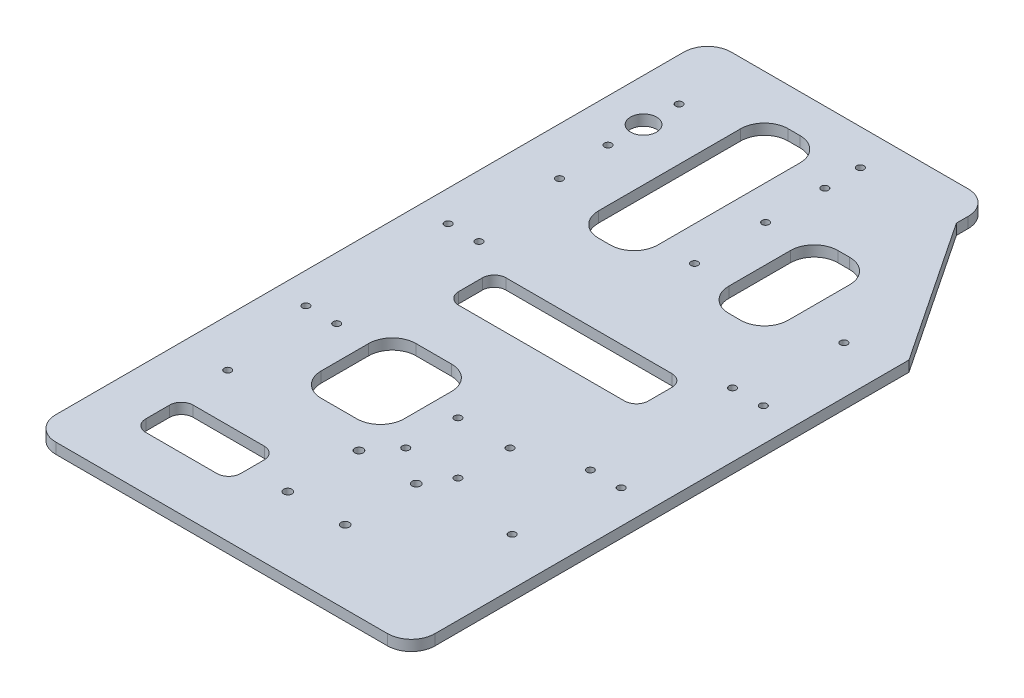
from build123d import *

# Parameters (mm, degrees)
EXTRUDE_1_DEPTH     = 4.5
SKETCH_3_R          = 1.75
CUT_EXTRUDE_2_DEPTH = 297.049404661
SKETCH_4_R          = 1.5
CUT_EXTRUDE_3_DEPTH = 297.049404661
FILLET_1_R          = 10
SKETCH_7_R          = 1.5
CUT_EXTRUDE_4_DEPTH = 297.049404661
SKETCH_8_R          = 1.5
CUT_EXTRUDE_5_DEPTH = 297.049404661
CUT_EXTRUDE_6_DEPTH = 297.049404661
SKETCH_10_R         = 5.5
CUT_EXTRUDE_7_DEPTH = 297.049404661
SKETCH_11_R         = 1.5
CUT_EXTRUDE_8_DEPTH = 297.049404661


with BuildPart() as part:
    # 草图1 → 凸台-拉伸1 (new body)
    with BuildSketch(Plane(origin=(0, 0, 0), x_dir=(1, 0, 0), z_dir=(0, 1, 0))):
        Polygon((-80, 0), (80, 0), (80, 210), (40, 270), (40, 285), (-80, 285), align=None)
    extrude(amount=EXTRUDE_1_DEPTH)

    # 草图3 → 切除-拉伸2 (cut, through all)
    with BuildSketch(Plane(origin=(0, 4.5, 0), x_dir=(1, 0, 0), z_dir=(0, 1, 0))):
        with Locations(Location((-2.95, 60.858418011, 0), (0, 0, 270))):
            Circle(SKETCH_3_R)
        with Locations(Location((21.25, 60.858418011, 0), (0, 0, 270))):
            Circle(SKETCH_3_R)
        with Locations(Location((21.25, 30.858418011, 0), (0, 0, 270))):
            Circle(SKETCH_3_R)
        with Locations(Location((-2.95, 30.858418011, 0), (0, 0, 270))):
            Circle(SKETCH_3_R)
    extrude(amount=-CUT_EXTRUDE_2_DEPTH, mode=Mode.SUBTRACT)

    # 草图4 → 切除-拉伸3 (cut, through all)
    with BuildSketch(Plane(origin=(0, 4.5, 0), x_dir=(1, 0, 0), z_dir=(0, 1, 0))):
        with Locations(Location((-60, 202.548224484, 0), (0, 0, 270))):
            Circle(SKETCH_4_R)
        with Locations(Location((-67, 162.548224484, 0), (0, 0, 270))):
            Circle(SKETCH_4_R)
        with Locations(Location((-54, 162.548224484, 0), (0, 0, 270))):
            Circle(SKETCH_4_R)
        with Locations(Location((-67, 102.548224484, 0), (0, 0, 270))):
            Circle(SKETCH_4_R)
        with Locations(Location((-54, 102.548224484, 0), (0, 0, 270))):
            Circle(SKETCH_4_R)
        with Locations(Location((-60, 62.548224484, 0), (0, 0, 270))):
            Circle(SKETCH_4_R)
        with Locations(Location((60, 62.548224484, 0), (0, 0, 270))):
            Circle(SKETCH_4_R)
        with Locations(Location((53, 102.548224484, 0), (0, 0, 270))):
            Circle(SKETCH_4_R)
        with Locations(Location((66, 102.548224484, 0), (0, 0, 270))):
            Circle(SKETCH_4_R)
        with Locations(Location((53, 162.548224484, 0), (0, 0, 270))):
            Circle(SKETCH_4_R)
        with Locations(Location((66, 162.548224484, 0), (0, 0, 270))):
            Circle(SKETCH_4_R)
        with Locations(Location((60, 202.548224484, 0), (0, 0, 270))):
            Circle(SKETCH_4_R)
    extrude(amount=-CUT_EXTRUDE_3_DEPTH, mode=Mode.SUBTRACT)

    # 圆角1
    fillet_1_edges = [part.edges().sort_by_distance(p)[0] for p in [
        (80, 2.25, 0),
        (-80, 2.25, 0),
        (-80, 2.25, -285),
        (40, 2.25, -285),
    ]]
    fillet(fillet_1_edges, radius=FILLET_1_R)

    # 草图7 → 切除-拉伸4 (cut, through all)
    with BuildSketch(Plane(origin=(0, 4.5, 0), x_dir=(1, 0, 0), z_dir=(0, 1, 0))):
        with Locations(Location((-62, 255, 0), (0, 0, 270))):
            Circle(SKETCH_7_R)
        with Locations(Location((-62, 225, 0), (0, 0, 270))):
            Circle(SKETCH_7_R)
    extrude(amount=-CUT_EXTRUDE_4_DEPTH, mode=Mode.SUBTRACT)

    # 草图8 → 切除-拉伸5 (cut, through all)
    with BuildSketch(Plane(origin=(0, 4.5, 0), x_dir=(1, 0, 0), z_dir=(0, 1, 0))):
        with Locations(Location((-0.5, 270, 0), (0, 0, 270))):
            Circle(SKETCH_8_R)
        with Locations(Location((-0.5, 255, 0), (0, 0, 270))):
            Circle(SKETCH_8_R)
        with Locations(Location((-0.5, 230, 0), (0, 0, 270))):
            Circle(SKETCH_8_R)
        with Locations(Location((-0.5, 200, 0), (0, 0, 270))):
            Circle(SKETCH_8_R)
    extrude(amount=-CUT_EXTRUDE_5_DEPTH, mode=Mode.SUBTRACT)

    # 草图9 → 切除-拉伸6 (cut, through all)
    with BuildSketch(Plane(origin=(0, 4.5, 0), x_dir=(1, 0, 0), z_dir=(0, 1, 0))):
        with BuildLine():
            Line((-30, 269), (-25, 269))
            ThreePointArc((-25, 269), (-17.928932188, 266.071067812), (-15, 259))
            Line((-15, 259), (-15, 199))
            ThreePointArc((-15, 199), (-17.928932188, 191.928932188), (-25, 189))
            Line((-25, 189), (-30, 189))
            ThreePointArc((-30, 189), (-37.071067812, 191.928932188), (-40, 199))
            Line((-40, 199), (-40, 259))
            ThreePointArc((-40, 259), (-37.071067812, 266.071067812), (-30, 269))
        make_face()
        with BuildLine():
            Line((25, 189), (30, 189))
            ThreePointArc((30, 189), (37.071067812, 191.928932188), (40, 199))
            Line((40, 199), (40, 225))
            ThreePointArc((40, 225), (37.071067812, 232.071067812), (30, 235))
            Line((30, 235), (25, 235))
            ThreePointArc((25, 235), (17.928932188, 232.071067812), (15, 225))
            Line((15, 225), (15, 199))
            ThreePointArc((15, 199), (17.928932188, 191.928932188), (25, 189))
        make_face()
        with BuildLine():
            Line((-35, 155), (35, 155))
            ThreePointArc((35, 155), (38.535533906, 153.535533906), (40, 150))
            Line((40, 150), (40, 140))
            ThreePointArc((40, 140), (38.535533906, 136.464466094), (35, 135))
            Line((35, 135), (-35, 135))
            ThreePointArc((-35, 135), (-38.535533906, 136.464466094), (-40, 140))
            Line((-40, 140), (-40, 150))
            ThreePointArc((-40, 150), (-38.535533906, 153.535533906), (-35, 155))
        make_face()
        with BuildLine():
            Line((-30, 112), (-15, 112))
            ThreePointArc((-15, 112), (-7.928932188, 109.071067812), (-5, 102))
            Line((-5, 102), (-5, 82))
            ThreePointArc((-5, 82), (-7.928932188, 74.928932188), (-15, 72))
            Line((-15, 72), (-30, 72))
            ThreePointArc((-30, 72), (-37.071067812, 74.928932188), (-40, 82))
            Line((-40, 82), (-40, 102))
            ThreePointArc((-40, 102), (-37.071067812, 109.071067812), (-30, 112))
        make_face()
        with BuildLine():
            Line((-54.5, 22.5), (-24.5, 22.5))
            ThreePointArc((-24.5, 22.5), (-20.964466094, 23.964466094), (-19.5, 27.5))
            Line((-19.5, 27.5), (-19.5, 37.5))
            ThreePointArc((-19.5, 37.5), (-20.964466094, 41.035533906), (-24.5, 42.5))
            Line((-24.5, 42.5), (-54.5, 42.5))
            ThreePointArc((-54.5, 42.5), (-58.035533906, 41.035533906), (-59.5, 37.5))
            Line((-59.5, 37.5), (-59.5, 27.5))
            ThreePointArc((-59.5, 27.5), (-58.035533906, 23.964466094), (-54.5, 22.5))
        make_face()
    extrude(amount=-CUT_EXTRUDE_6_DEPTH, mode=Mode.SUBTRACT)

    # 草图10 → 切除-拉伸7 (cut, through all)
    with BuildSketch(Plane(origin=(0, 4.5, 0), x_dir=(1, 0, 0), z_dir=(0, 1, 0))):
        with Locations(Location((-62, 240, 0), (0, 0, 270))):
            Circle(SKETCH_10_R)
    extrude(amount=-CUT_EXTRUDE_7_DEPTH, mode=Mode.SUBTRACT)

    # 草图11 → 切除-拉伸8 (cut, through all)
    with BuildSketch(Plane(origin=(0, 4.5, 0), x_dir=(1, 0, 0), z_dir=(0, 1, 0))):
        with Locations(Location((6, 93.669023571, 0), (0, 0, 270))):
            Circle(SKETCH_11_R)
        with Locations(Location((28, 93.669023571, 0), (0, 0, 270))):
            Circle(SKETCH_11_R)
        with Locations(Location((6, 71.669023571, 0), (0, 0, 270))):
            Circle(SKETCH_11_R)
        with Locations(Location((28, 71.669023571, 0), (0, 0, 270))):
            Circle(SKETCH_11_R)
    extrude(amount=-CUT_EXTRUDE_8_DEPTH, mode=Mode.SUBTRACT)


solid = part.part
